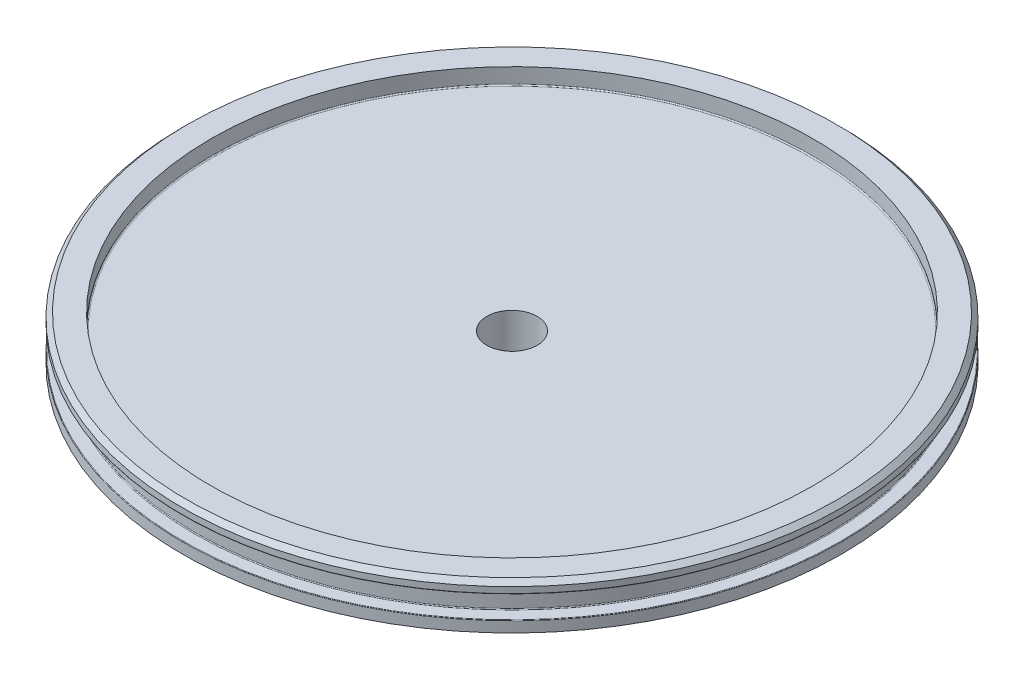
from build123d import *

# Parameters (mm, degrees)
SKETCH6_R                        = 66.04
BOSS_EXTRUDE1_DEPTH              = 2.54
PIPE_TAP_DRILL_FOR_1_4_TAP_GN2_D = 11.1252
CNC_ID_FILLET_R                  = 0.1778
CNC_OD_FILLET_R                  = 0.127
CNC_CHAMFERS_SIZE                = 1.016
CNC_BORE_FILLET_R                = 0.254


with BuildPart() as part:
    # Sketch1 → Revolve1 (revolve)
    with BuildSketch(Plane.XY, mode=Mode.PRIVATE) as revolve1_sk:
        Polygon((0, 0), (72.898, 0), (72.898, 2.4638), (69.977, 2.4638), (69.977, 7.4422), (72.898, 7.4422), (72.898, 9.906), (66.548, 9.906), (66.548, 6.35), (0, 6.35), align=None)
    revolve(revolve1_sk.sketch.rotate(Axis((0, 48.192213231, 0), (0, -1, 0)), 180), axis=Axis((0, 48.192213231, 0), (0, -1, 0)))

    # Sketch6 → Boss-Extrude1 (add)
    with BuildSketch(Plane.XZ):
        Circle(SKETCH6_R)
    extrude(amount=BOSS_EXTRUDE1_DEPTH)

    # Pipe Tap Drill for 1/4 Tap - GN2 (through all)
    with Locations(Plane(origin=(0, 6.35, 0), x_dir=(1, 0, 0), z_dir=(0, 1, 0))):
        with Locations((0, 0)):
            Hole(PIPE_TAP_DRILL_FOR_1_4_TAP_GN2_D / 2)

    # CNC ID Fillet
    cnc_id_fillet_edges = [part.edges().sort_by_distance(p)[0] for p in [
        (69.977, 7.4422, 0),
        (69.977, 2.4638, 0),
        (-66.04, 0, 0),
    ]]
    fillet(cnc_id_fillet_edges, radius=CNC_ID_FILLET_R)

    # CNC OD Fillet
    cnc_od_fillet_edges = [part.edges().sort_by_distance(p)[0] for p in [
        (72.898, 2.4638, 0),
        (-66.04, -2.54, 0),
        (72.898, 7.4422, 0),
    ]]
    fillet(cnc_od_fillet_edges, radius=CNC_OD_FILLET_R)

    # CNC Chamfers
    cnc_chamfers_edges = [part.edges().sort_by_distance(p)[0] for p in [
        (72.898, 9.906, 0),
    ]]
    chamfer(cnc_chamfers_edges, length=CNC_CHAMFERS_SIZE)

    # CNC Bore Fillet
    cnc_bore_fillet_edges = [part.edges().sort_by_distance(p)[0] for p in [
        (66.548, 6.35, 0),
    ]]
    fillet(cnc_bore_fillet_edges, radius=CNC_BORE_FILLET_R)


solid = part.part
